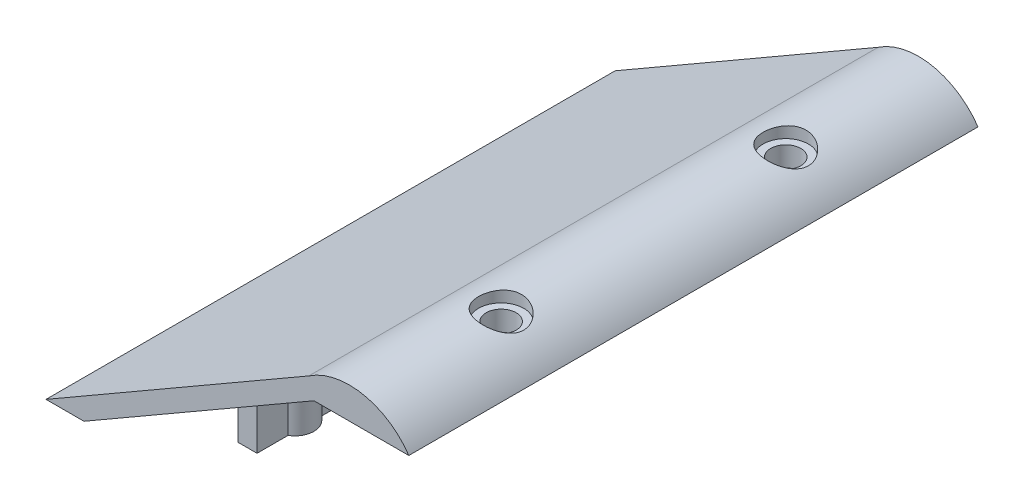
from build123d import *

# Parameters (mm, degrees)
SALIENTE_EXTRUIR2_DEPTH             = 75
SALIENTE_EXTRUIR5_DEPTH             = 17
SALIENTE_EXTRUIR5_DIRECTION_2_REACH = 107.612
CROQUIS6_R                          = 3.96875
CORTAR_EXTRUIR2_DEPTH               = 20
CROQUIS16_R                         = 5.96875
CROQUIS16_R_2                       = 3.96875
CORTAR_EXTRUIR3_DEPTH               = 3
CROQUIS17_R                         = 1
CORTAR_EXTRUIR4_DEPTH               = 13


with BuildPart() as part:
    # Croquis1 → Saliente-Extruir2 (new, symmetric)
    with BuildSketch(Plane.XY):
        with BuildLine():
            ThreePointArc((-1.339745962, 5), (12.862399029, 7.937956503), (25, 0))
            Line((25, 0), (0, 0))
            Line((0, 0), (-60.621778265, -35))
            Line((-60.621778265, -35), (-70.621778265, -35))
            Line((-70.621778265, -35), (-1.339745962, 5))
        make_face()
    extrude(amount=SALIENTE_EXTRUIR2_DEPTH, both=True)

    # Croquis3 → Saliente-Extruir5 (add)
    with BuildSketch(Plane.XZ.offset(15)):
        with BuildLine():
            Line((-32.5, 4.330127019), (-32.5, 12.5))
            Line((-32.5, 12.5), (-27.5, 12.5))
            Line((-27.5, 12.5), (-27.5, 4.330127019))
            ThreePointArc((-27.5, 4.330127019), (-25, 0), (-27.5, -4.330127019))
            Line((-27.5, -4.330127019), (-27.5, -12.5))
            Line((-27.5, -12.5), (-32.5, -12.5))
            Line((-32.5, -12.5), (-32.5, -4.330127019))
            ThreePointArc((-32.5, -4.330127019), (-35, 0), (-32.5, 4.330127019))
        make_face()
        with BuildLine():
            Line((-27.5, -45.669872981), (-27.5, -37.5))
            Line((-27.5, -37.5), (-32.5, -37.5))
            Line((-32.5, -37.5), (-32.5, -45.669872981))
            ThreePointArc((-32.5, -45.669872981), (-35, -50), (-32.5, -54.330127019))
            Line((-32.5, -54.330127019), (-32.5, -62.5))
            Line((-32.5, -62.5), (-27.5, -62.5))
            Line((-27.5, -62.5), (-27.5, -54.330127019))
            ThreePointArc((-27.5, -54.330127019), (-25, -50), (-27.5, -45.669872981))
        make_face()
        with BuildLine():
            Line((-27.5, 54.330127019), (-27.5, 62.5))
            Line((-27.5, 62.5), (-32.5, 62.5))
            Line((-32.5, 62.5), (-32.5, 54.330127019))
            ThreePointArc((-32.5, 54.330127019), (-35, 50), (-32.5, 45.669872981))
            Line((-32.5, 45.669872981), (-32.5, 37.5))
            Line((-32.5, 37.5), (-27.5, 37.5))
            Line((-27.5, 37.5), (-27.5, 45.669872981))
            ThreePointArc((-27.5, 45.669872981), (-25, 50), (-27.5, 54.330127019))
        make_face()
    extrude(amount=SALIENTE_EXTRUIR5_DEPTH)

    # Saliente-Extruir5 direction 2: up to this face of the body (flat: up to its plane)
    saliente_extruir5_direction_2_end = Plane(part.part.faces().sort_by_distance((-30.310889132, -17.5, 0))[0])
    # Croquis3 → Saliente-Extruir5 direction 2 (add, up to the picked face)
    with BuildSketch(Plane.XZ.offset(15), mode=Mode.PRIVATE) as saliente_extruir5_direction_2_sk1:
        with BuildLine():
            Line((-32.5, 4.330127019), (-32.5, 12.5))
            Line((-32.5, 12.5), (-27.5, 12.5))
            Line((-27.5, 12.5), (-27.5, 4.330127019))
            ThreePointArc((-27.5, 4.330127019), (-25, 0), (-27.5, -4.330127019))
            Line((-27.5, -4.330127019), (-27.5, -12.5))
            Line((-27.5, -12.5), (-32.5, -12.5))
            Line((-32.5, -12.5), (-32.5, -4.330127019))
            ThreePointArc((-32.5, -4.330127019), (-35, 0), (-32.5, 4.330127019))
        make_face()
    saliente_extruir5_direction_2_tool1 = split(extrude(saliente_extruir5_direction_2_sk1.sketch, amount=-SALIENTE_EXTRUIR5_DIRECTION_2_REACH, mode=Mode.PRIVATE), bisect_by=saliente_extruir5_direction_2_end, keep=Keep.BOTH, mode=Mode.PRIVATE)
    # Croquis3 → Saliente-Extruir5 direction 2 (add, up to the picked face)
    with BuildSketch(Plane.XZ.offset(15), mode=Mode.PRIVATE) as saliente_extruir5_direction_2_sk2:
        with BuildLine():
            Line((-27.5, -45.669872981), (-27.5, -37.5))
            Line((-27.5, -37.5), (-32.5, -37.5))
            Line((-32.5, -37.5), (-32.5, -45.669872981))
            ThreePointArc((-32.5, -45.669872981), (-35, -50), (-32.5, -54.330127019))
            Line((-32.5, -54.330127019), (-32.5, -62.5))
            Line((-32.5, -62.5), (-27.5, -62.5))
            Line((-27.5, -62.5), (-27.5, -54.330127019))
            ThreePointArc((-27.5, -54.330127019), (-25, -50), (-27.5, -45.669872981))
        make_face()
    saliente_extruir5_direction_2_tool2 = split(extrude(saliente_extruir5_direction_2_sk2.sketch, amount=-SALIENTE_EXTRUIR5_DIRECTION_2_REACH, mode=Mode.PRIVATE), bisect_by=saliente_extruir5_direction_2_end, keep=Keep.BOTH, mode=Mode.PRIVATE)
    # Croquis3 → Saliente-Extruir5 direction 2 (add, up to the picked face)
    with BuildSketch(Plane.XZ.offset(15), mode=Mode.PRIVATE) as saliente_extruir5_direction_2_sk3:
        with BuildLine():
            Line((-27.5, 54.330127019), (-27.5, 62.5))
            Line((-27.5, 62.5), (-32.5, 62.5))
            Line((-32.5, 62.5), (-32.5, 54.330127019))
            ThreePointArc((-32.5, 54.330127019), (-35, 50), (-32.5, 45.669872981))
            Line((-32.5, 45.669872981), (-32.5, 37.5))
            Line((-32.5, 37.5), (-27.5, 37.5))
            Line((-27.5, 37.5), (-27.5, 45.669872981))
            ThreePointArc((-27.5, 45.669872981), (-25, 50), (-27.5, 54.330127019))
        make_face()
    saliente_extruir5_direction_2_tool3 = split(extrude(saliente_extruir5_direction_2_sk3.sketch, amount=-SALIENTE_EXTRUIR5_DIRECTION_2_REACH, mode=Mode.PRIVATE), bisect_by=saliente_extruir5_direction_2_end, keep=Keep.BOTH, mode=Mode.PRIVATE)
    add(saliente_extruir5_direction_2_tool1.solids().sort_by(Axis((-30, -15, 0), (0, 1, 0)))[0])
    add(saliente_extruir5_direction_2_tool2.solids().sort_by(Axis((-30, -15, -50), (0, 1, 0)))[0])
    add(saliente_extruir5_direction_2_tool3.solids().sort_by(Axis((-30, -15, 50), (0, 1, 0)))[0])

    # Croquis6 → Cortar-Extruir2 (cut)
    with BuildSketch(Plane(origin=(0, 8.271300641, 0), x_dir=(1, 0, 0), z_dir=(0, 1, 0))):
        with Locations(Location((11.830127019, 37.5, 0), (0, 0, 270))):
            Circle(CROQUIS6_R)
        with Locations(Location((11.830127019, -37.5, 0), (0, 0, 270))):
            Circle(CROQUIS6_R)
    extrude(amount=-CORTAR_EXTRUIR2_DEPTH, mode=Mode.SUBTRACT)

    # Croquis16 → Cortar-Extruir3 (cut)
    # profile 1 of 2: a face of its own
    with BuildSketch(Plane(origin=(0, 8.271300641, 0), x_dir=(1, 0, 0), z_dir=(0, 1, 0))):
        with Locations(Location((11.830127019, 37.5, 0), (0, 0, 270))):
            Circle(CROQUIS16_R)
        with Locations(Location((11.830127019, 37.5, 0), (0, 0, 270))):
            Circle(CROQUIS16_R_2, mode=Mode.SUBTRACT)
    # profile 2 of 2: a face of its own
    with BuildSketch(Plane(origin=(0, 8.271300641, 0), x_dir=(1, 0, 0), z_dir=(0, 1, 0))):
        with Locations(Location((11.830127019, -37.5, 0), (0, 0, 270))):
            Circle(CROQUIS16_R)
        with Locations(Location((11.830127019, -37.5, 0), (0, 0, 270))):
            Circle(CROQUIS16_R_2, mode=Mode.SUBTRACT)
    extrude(amount=-CORTAR_EXTRUIR3_DEPTH, mode=Mode.SUBTRACT)

    # Croquis17 → Cortar-Extruir4 (cut)
    with BuildSketch(Plane.XZ.offset(32)):
        with Locations(Location((-30, 50, 0), (0, 0, 270))):
            Circle(CROQUIS17_R)
        with Locations(Location((-30, 0, 0), (0, 0, 270))):
            Circle(CROQUIS17_R)
        with Locations(Location((-30, -50, 0), (0, 0, 270))):
            Circle(CROQUIS17_R)
    extrude(amount=-CORTAR_EXTRUIR4_DEPTH, mode=Mode.SUBTRACT)


solid = part.part
